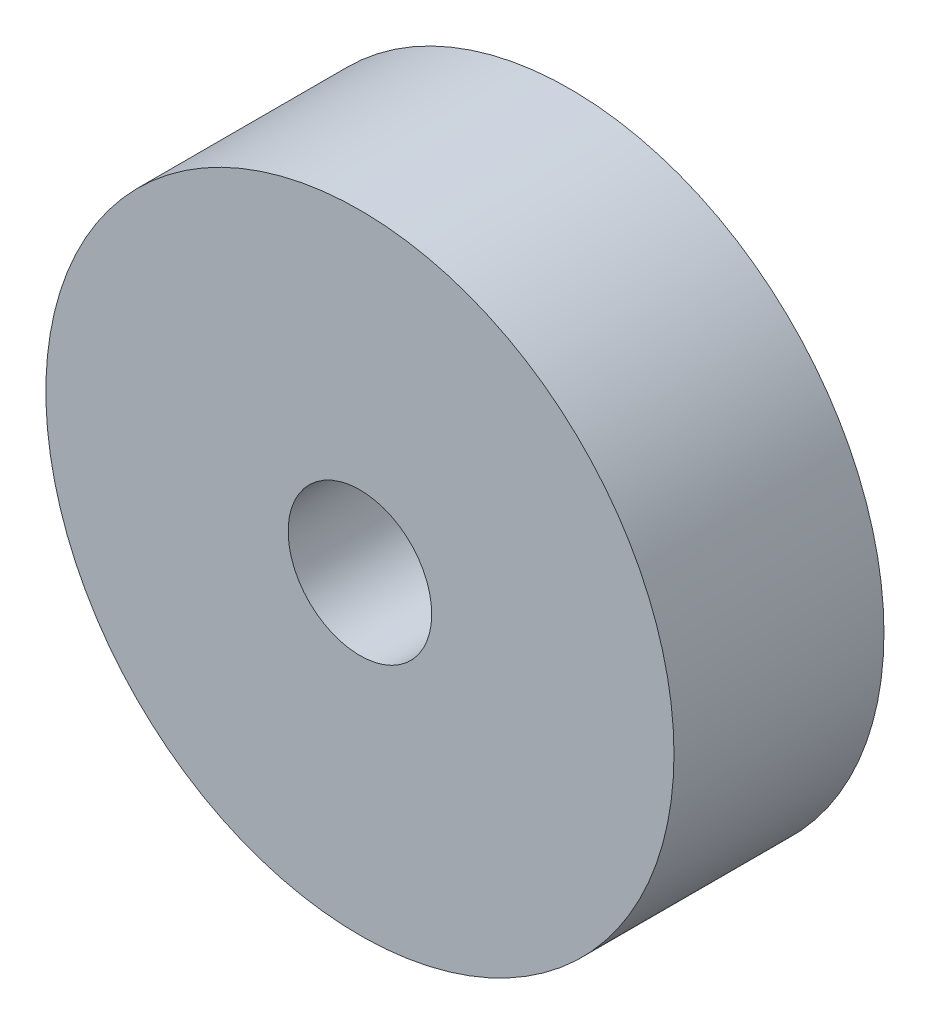
from build123d import *

# Parameters (mm, degrees)
CROQUIS1_R              = 17.5
CROQUIS1_R_2            = 4
SALIENTE_EXTRUIR1_DEPTH = 5.85


with BuildPart() as part:
    # Croquis1 → Saliente-Extruir1 (new, symmetric)
    with BuildSketch(Plane.XY):
        Circle(CROQUIS1_R)
        Circle(CROQUIS1_R_2, mode=Mode.SUBTRACT)
    extrude(amount=SALIENTE_EXTRUIR1_DEPTH, both=True)


solid = part.part
